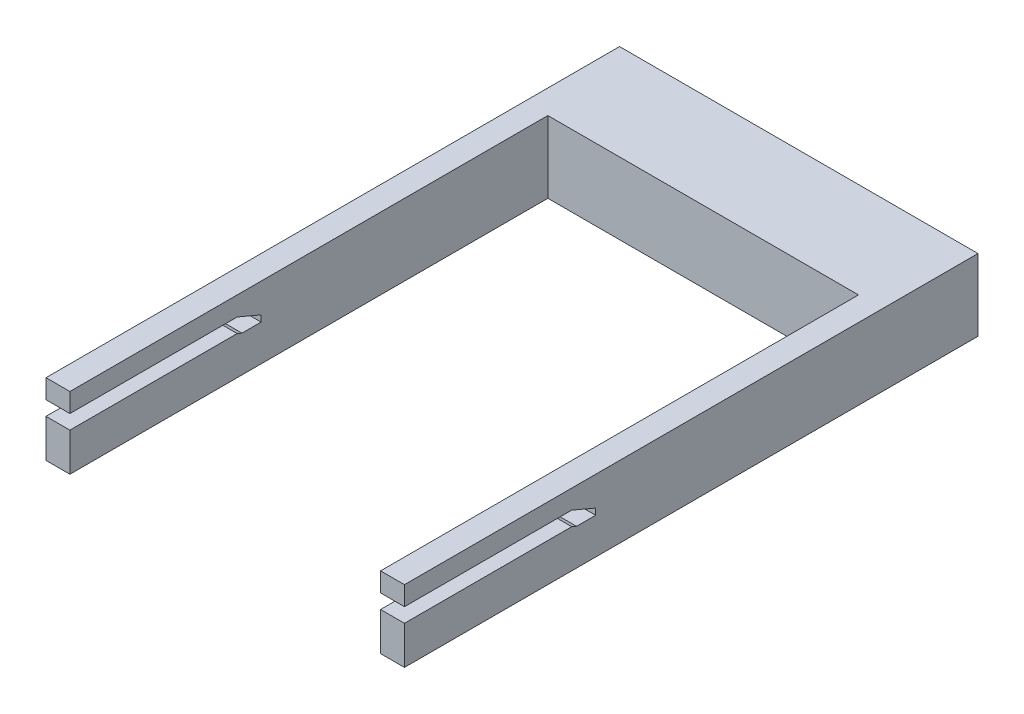
from build123d import *

# Parameters (mm, degrees)
BOSS_EXTRUDE1_DEPTH = 15
CUT_EXTRUDE1_DEPTH  = 37.5


with BuildPart() as part:
    # Sketch1 → Boss-Extrude1 (new body)
    with BuildSketch(Plane(origin=(0, 0, 0), x_dir=(1, 0, 0), z_dir=(0, 1, 0))):
        Polygon((32.5, -60), (37.5, -60), (37.5, 60), (-37.5, 60), (-37.5, -60), (-32.5, -60), (-32.5, 40), (32.5, 40), align=None)
    extrude(amount=BOSS_EXTRUDE1_DEPTH)

    # Sketch2 → Cut-Extrude1 (cut, symmetric)
    with BuildSketch(Plane(origin=(0, 0, 0), x_dir=(0, 0, -1), z_dir=(1, 0, 0))):
        Polygon((-60, 11), (-25, 11), (-20, 8.877625919), (-20, 7.575525184), (-24, 7.575525184), (-25, 8), (-60, 8), align=None)
    extrude(amount=CUT_EXTRUDE1_DEPTH, both=True, mode=Mode.SUBTRACT)


solid = part.part
